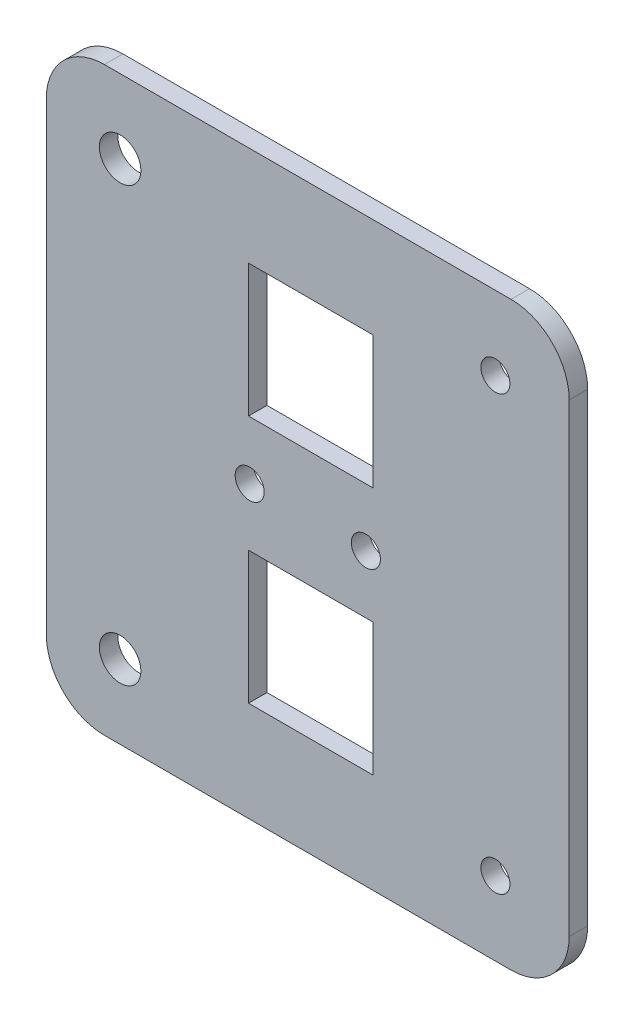
from build123d import *

# Parameters (mm, degrees)
BOSS_EXTRUDE1_START     = 19.16
SKETCH1_W               = 90
SKETCH1_H               = 100
SKETCH1_R               = 2.5
SKETCH1_R_2             = 3.57
BOSS_EXTRUDE1_DEPTH     = 3.18
FILLET1_R               = 10
SKETCH2_R               = 2.5
CUT_EXTRUDE1_DEPTH      = 10
SKETCH3_W               = 21.4
SKETCH3_H               = 22.810510703
CUT_EXTRUDE2_DEPTH      = 72.134467033
CUT_EXTRUDE4_DEPTH      = 85.287566546
CUT_EXTRUDE4_DEPTH_BACK = 85.287566546
SKETCH20_R              = 2.5


with BuildPart() as part:
    # Sketch1 → Boss-Extrude1 (new body)
    with BuildSketch(Plane.XY.offset(BOSS_EXTRUDE1_START)):
        with Locations((0, -5)):
            Rectangle(SKETCH1_W, SKETCH1_H)
        with Locations((32.3, -42.3)):
            Circle(SKETCH1_R, mode=Mode.SUBTRACT)
        with Locations((-32.3, -42.3)):
            Circle(SKETCH1_R_2, mode=Mode.SUBTRACT)
        with Locations((-32.3, 32.3)):
            Circle(SKETCH1_R_2, mode=Mode.SUBTRACT)
        with Locations((32.3, 32.3)):
            Circle(SKETCH1_R, mode=Mode.SUBTRACT)
    extrude(amount=-BOSS_EXTRUDE1_DEPTH)

    # Fillet1
    fillet1_edges = [part.edges().sort_by_distance(p)[0] for p in [
        (-45, 45, 17.57),
        (45, 45, 17.57),
        (45, -55, 17.57),
        (-45, -55, 17.57),
    ]]
    fillet(fillet1_edges, radius=FILLET1_R)

    # Sketch2 → Cut-Extrude1 (cut)
    with BuildSketch(Plane.XY.offset(19.16)):
        with Locations((10, -5)):
            Circle(SKETCH2_R)
        with Locations((-10, -5)):
            Circle(SKETCH2_R)
    extrude(amount=-CUT_EXTRUDE1_DEPTH, mode=Mode.SUBTRACT)

    # Sketch3 → Cut-Extrude2 (cut, through all)
    with BuildSketch(Plane(origin=(0, 0, 15.98), x_dir=(-1, 0, 0), z_dir=(0, 0, -1))):
        with Locations((-0.5, 16.405255352)):
            Rectangle(SKETCH3_W, SKETCH3_H)
        with Locations((-0.5, -26.405255352)):
            Rectangle(SKETCH3_W, SKETCH3_H)
    extrude(amount=-CUT_EXTRUDE2_DEPTH, mode=Mode.SUBTRACT)

    # Sketch20 → Cut-Extrude4 (cut, two sides: drawn at the far end of the back side and taken through both)
    with BuildSketch(Plane(origin=(15.928550568, 0, 0), x_dir=(0, 0, -1), z_dir=(1, 0, 0)).offset(-CUT_EXTRUDE4_DEPTH_BACK)):
        with Locations((-11.083959348, 15.905495278)):
            Circle(SKETCH20_R)
    extrude(amount=CUT_EXTRUDE4_DEPTH + CUT_EXTRUDE4_DEPTH_BACK, mode=Mode.SUBTRACT)


solid = part.part
